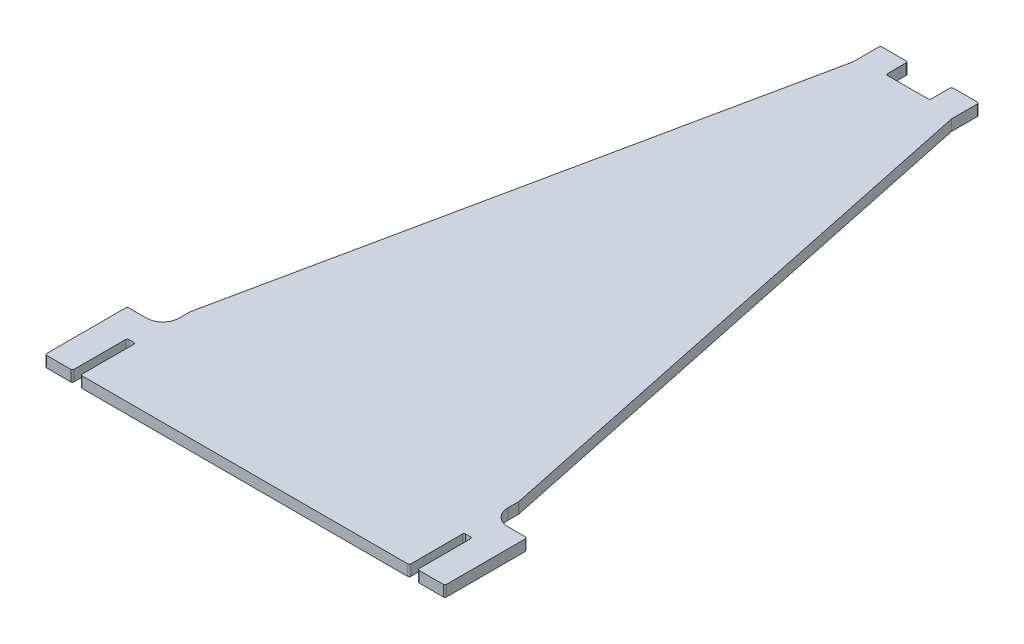
from build123d import *

# Parameters (mm, degrees)
BOSS_EXTRUDE1_DEPTH = 0.2
FILLET1_R           = 0.3
FILLET2_R           = 0.03


with BuildPart() as part:
    # Sketch1 → Boss-Extrude1 (new body)
    with BuildSketch(Plane(origin=(0, 0, 0), x_dir=(1, 0, 0), z_dir=(0, 1, 0))):
        Polygon((0, 0), (0, 1.5), (0.65, 1.5), (0.65, 2), (2.75, 12), (2.75, 12.5), (3.25, 12.5), (3.25, 12.1), (4.05, 12.1), (4.05, 12.5), (4.55, 12.5), (4.55, 12), (6.65, 2), (6.65, 1.5), (7.3, 1.5), (7.3, 0), (6.8, 0), (6.8, 1), (6.65, 1), (6.65, 0), (0.65, 0), (0.65, 1), (0.5, 1), (0.5, 0), align=None)
    extrude(amount=BOSS_EXTRUDE1_DEPTH)

    # Fillet1
    fillet1_edges = [part.edges().sort_by_distance(p)[0] for p in [
        (0.65, 0.1, -1.5),
        (6.65, 0.1, -1.5),
    ]]
    fillet(fillet1_edges, radius=FILLET1_R)

    # Fillet2
    fillet2_edges = [part.edges().sort_by_distance(p)[0] for p in [
        (0, 0.1, 0),
        (0, 0.1, -1.5),
        (0.65, 0.1, -2),
        (2.75, 0.1, -12),
        (2.75, 0.1, -12.5),
        (3.25, 0.1, -12.5),
        (3.25, 0.1, -12.1),
        (4.05, 0.1, -12.1),
        (4.05, 0.1, -12.5),
        (4.55, 0.1, -12.5),
        (4.55, 0.1, -12),
        (6.65, 0.1, -2),
        (7.3, 0.1, -1.5),
        (7.3, 0.1, 0),
        (6.8, 0.1, 0),
        (6.8, 0.1, -1),
        (6.65, 0.1, -1),
        (6.65, 0.1, 0),
        (0.65, 0.1, 0),
        (0.65, 0.1, -1),
        (0.5, 0.1, -1),
        (0.5, 0.1, 0),
    ]]
    fillet(fillet2_edges, radius=FILLET2_R)


solid = part.part
